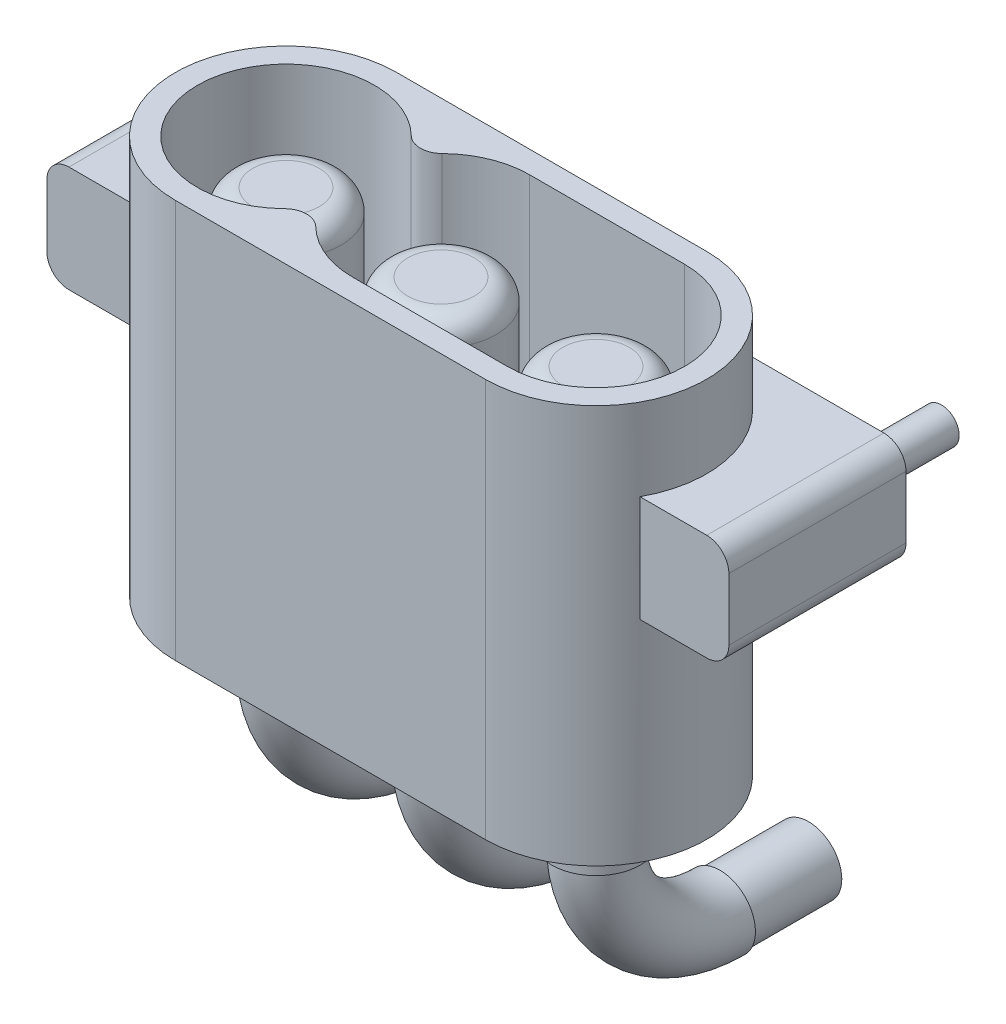
from build123d import *
from build123d.topology import SkipClean

# Parameters (mm, degrees)
SKETCH_1_R             = 0.75
EXTRUDE_1_DEPTH        = 2
SKETCH_2_R             = 0.8
SKETCH_4_R             = 1
EXTRUDE_2_DEPTH        = 1.25
EXTRUDE_3_DEPTH        = 9
SKETCH_6_R             = 0.4
EXTRUDE_4_DEPTH        = 2
EXTRUDE_4_2_DEPTH      = 2
SKETCH_7_W             = 4.2
SKETCH_7_H             = 2.4
EXTRUDE_5_DEPTH        = 4
CUT_EXTRUDE_3_DEPTH    = 7
SKETCH_9_R             = 1.25
EXTRUDE_7_DEPTH        = 6
PATTERN_LINEAR_2_COUNT = 3
PATTERN_LINEAR_2_PITCH = 3.5
EXTRUDE_8_REACH        = 20.584
FILLET_1_R             = 0.5
FILLET_3_R             = 0.5
FILLET_4_R             = 0.5


with BuildPart() as part:
    # ｽｹｯﾁ1 → ﾎﾞｽ - 押し出し1 (new body)
    with BuildSketch(Plane.XY):
        Circle(SKETCH_1_R)
    extrude_1 = extrude(amount=-EXTRUDE_1_DEPTH)

    # ｽｲｰﾌﾟ1: sweep along a path in ｽｹｯﾁ3
    with BuildLine(Plane(origin=(0, 0, 0), x_dir=(0, 0, -1), z_dir=(1, 0, 0))) as sweep_1_path:
        ThreePointArc((0, 0), (-1.979898987, 0.820101013), (-2.8, 2.8))
    # ｽｹｯﾁ2 → ｽｲｰﾌﾟ1 (sweep)
    with BuildSketch(Plane.XY):
        Circle(SKETCH_2_R)
    sweep_1 = sweep(path=sweep_1_path.line)

    # ｽｹｯﾁ4 → ﾎﾞｽ - 押し出し2 (add)
    with BuildSketch(Plane(origin=(0, 2.8, 0), x_dir=(1, 0, 0), z_dir=(0, 1, 0))):
        with Locations(Location((0, -2.8, 0), (0, 0, 270))):
            Circle(SKETCH_4_R)
    extrude_2 = extrude(amount=EXTRUDE_2_DEPTH)

    # ｽｹｯﾁ5 → ﾎﾞｽ - 押し出し3 (add)
    with BuildSketch(Plane(origin=(0, 4.05, 0), x_dir=(1, 0, 0), z_dir=(0, 1, 0))):
        with BuildLine():
            Line((0, -5.3), (7, -5.3))
            ThreePointArc((7, -5.3), (9.5, -2.8), (7, -0.3))
            Line((7, -0.3), (0, -0.3))
            ThreePointArc((0, -0.3), (-2.5, -2.8), (0, -5.3))
        make_face()
    extrude(amount=EXTRUDE_3_DEPTH)



with BuildPart() as body_2:
    # ｽｹｯﾁ6 → ﾎﾞｽ - 押し出し4 (new body)
    with BuildSketch(Plane.XY):
        with Locations((10, 10)):
            Circle(SKETCH_6_R)
    extrude(amount=-EXTRUDE_4_DEPTH)


with BuildPart() as body_3:
    # ｽｹｯﾁ6 → Extrude 4 2 (new body)
    with BuildSketch(Plane.XY):
        with Locations((-3, 10)):
            Circle(SKETCH_6_R)
    extrude(amount=-EXTRUDE_4_2_DEPTH)


with BuildPart() as part_1:
    add(part.part)

    add(body_2.part)  # ﾎﾞｽ - 押し出し5 merges body 2
    # ｽｹｯﾁ7 → ﾎﾞｽ - 押し出し5 (add)
    with BuildSketch(Plane.XY):
        with Locations((9.1, 10)):
            Rectangle(SKETCH_7_W, SKETCH_7_H)
        with Locations((-2.1, 10)):
            Rectangle(SKETCH_7_W, SKETCH_7_H)
    extrude(amount=EXTRUDE_5_DEPTH)

    # ｽｹｯﾁ8 → ｶｯﾄ - 押し出し3 (cut)
    with BuildSketch(Plane(origin=(0, 13.05, 0), x_dir=(1, 0, 0), z_dir=(0, 1, 0))):
        with BuildLine():
            Line((7, -0.8), (0, -0.8))
            ThreePointArc((0, -0.8), (-2, -2.8), (0, -4.8))
            Line((0, -4.8), (7, -4.8))
            ThreePointArc((7, -4.8), (9, -2.8), (7, -0.8))
        make_face()
    extrude(amount=-CUT_EXTRUDE_3_DEPTH, mode=Mode.SUBTRACT)

    # ｽｹｯﾁ9 → ﾎﾞｽ - 押し出し7 (add)
    with BuildSketch(Plane(origin=(0, 6.05, 0), x_dir=(1, 0, 0), z_dir=(0, 1, 0))):
        with Locations(Location((0, -2.8, 0), (0, 0, 90))):
            Circle(SKETCH_9_R)
    extrude_7 = extrude(amount=EXTRUDE_7_DEPTH)

    # 直線ﾊﾟﾀｰﾝ2: ﾎﾞｽ - 押し出し1, ｽｲｰﾌﾟ1, ﾎﾞｽ - 押し出し2, ﾎﾞｽ - 押し出し7 ×3
    with Locations(*[(i * PATTERN_LINEAR_2_PITCH, 0, 0) for i in range(1, PATTERN_LINEAR_2_COUNT)]):
        add(extrude_1)
        add(sweep_1)
        add(extrude_2)
        add(extrude_7)

    # ｽｹｯﾁ10 → ﾎﾞｽ - 押し出し8 (add, up to next)
    with BuildSketch(Plane(origin=(0, 13.05, 0), x_dir=(1, 0, 0), z_dir=(0, 1, 0)), mode=Mode.PRIVATE) as extrude_8_sk1:
        with BuildLine():
            Line((0, -0.8), (3.5, -0.8))
            ThreePointArc((3.5, -0.8), (2.484246997, -1.077140216), (1.75, -1.831754163))
            ThreePointArc((1.75, -1.831754163), (1.015753003, -1.077140216), (0, -0.8))
        make_face()
    extrude_8_tool1 = extrude(extrude_8_sk1.sketch, amount=-EXTRUDE_8_REACH, mode=Mode.PRIVATE) - part_1.part
    extrude_8 = extrude_8_tool1.solids().sort_by_distance((1.75, 13.05, 1.088549))[0]
    add(extrude_8)

    # ﾐﾗｰ19: ﾎﾞｽ - 押し出し8 across plane
    with SkipClean():  # the faces are left unmerged after this step: merging them gives an invalid solid
        add(extrude_8.mirror(Plane(origin=(0, 0, 2.8), x_dir=(1, 0, 0), z_dir=(0, 0, -1))))

    # ﾌｨﾚｯﾄ1
    fillet_1_edges = [part_1.edges().sort_by_distance(p)[0] for p in [
        (11.2, 8.8, 2),
        (11.2, 11.2, 2),
        (-4.2, 11.2, 2),
        (-4.2, 8.8, 2),
    ]]
    fillet(fillet_1_edges, radius=FILLET_1_R)

    # ﾌｨﾚｯﾄ3
    fillet_3_edges = [part_1.edges().sort_by_distance(p)[0] for p in [
        (1.75, 9.55, 1.831754163),
        (1.75, 9.55, 3.768245837),
    ]]
    fillet(fillet_3_edges, radius=FILLET_3_R)

    # ﾌｨﾚｯﾄ4
    fillet_4_edges = [part_1.edges().sort_by_distance(p)[0] for p in [
        (3.5, 12.05, 4.05),
        (7, 12.05, 4.05),
        (0, 12.05, 4.05),
    ]]
    fillet(fillet_4_edges, radius=FILLET_4_R)


solid = Compound([body_3.part, part_1.part])
